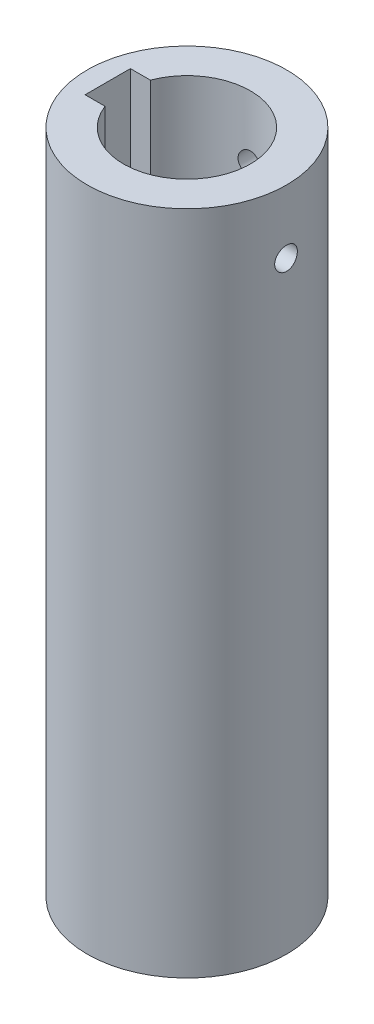
from build123d import *

# Parameters (mm, degrees)
SKETCH1_R               = 11
SKETCH1_R_2             = 7
BOSS_EXTRUDE1_DEPTH     = 36.75
SKETCH2_R               = 1.25
CUT_EXTRUDE1_DEPTH      = 10
CIRPATTERN1_COUNT       = 2
CIRPATTERN1_ANGLE       = 90
CUT_EXTRUDE2_DEPTH      = 76.128223855
CUT_EXTRUDE2_DEPTH_BACK = 76.128223855


with BuildPart() as part:
    # Sketch1 → Boss-Extrude1 (new, symmetric)
    with BuildSketch(Plane(origin=(0, 0, 0), x_dir=(1, 0, 0), z_dir=(0, 1, 0))):
        with Locations(Location((0, 0, 0), (0, 0, 270))):
            Circle(SKETCH1_R)
        with Locations(Location((0, 0, 0), (0, 0, 270))):
            Circle(SKETCH1_R_2, mode=Mode.SUBTRACT)
    extrude(amount=BOSS_EXTRUDE1_DEPTH, both=True)

    # Sketch2 → Cut-Extrude1 (cut)
    with BuildSketch(Plane(origin=(0, 0, -11), x_dir=(-1, 0, 0), z_dir=(0, 0, -1))):
        with Locations(Location((0, 29.75, 0), (0, 0, 90))):
            Circle(SKETCH2_R)
    cut_extrude1 = extrude(amount=-CUT_EXTRUDE1_DEPTH, mode=Mode.SUBTRACT)

    # CirPattern1: Cut-Extrude1 ×2 about axis
    cirpattern1_axis = Axis((0, 36.75, 0), (0, -1, 0))
    for i in range(1, CIRPATTERN1_COUNT):
        add(cut_extrude1.rotate(cirpattern1_axis, i * CIRPATTERN1_ANGLE / (CIRPATTERN1_COUNT - 1)), mode=Mode.SUBTRACT)

    # Sketch4 → Cut-Extrude2 (cut, two sides: drawn at the far end of the back side and taken through both)
    with BuildSketch(Plane(origin=(0, 36.75, 0), x_dir=(1, 0, 0), z_dir=(0, 1, 0)).offset(-CUT_EXTRUDE2_DEPTH_BACK)):
        with BuildLine():
            ThreePointArc((-6.565325544, 2.428271092), (-6.551935139, 2.464172464), (-6.538348415, 2.5))
            Line((-6.538348415, 2.5), (-8.738348415, 2.5))
            Line((-8.738348415, 2.5), (-8.738348415, -2.5))
            Line((-8.738348415, -2.5), (-6.538348415, -2.5))
            ThreePointArc((-6.538348415, -2.5), (-6.999895128, -0.038317104), (-6.565325544, 2.428271092))
        make_face()
    extrude(amount=CUT_EXTRUDE2_DEPTH + CUT_EXTRUDE2_DEPTH_BACK, mode=Mode.SUBTRACT)


solid = part.part
